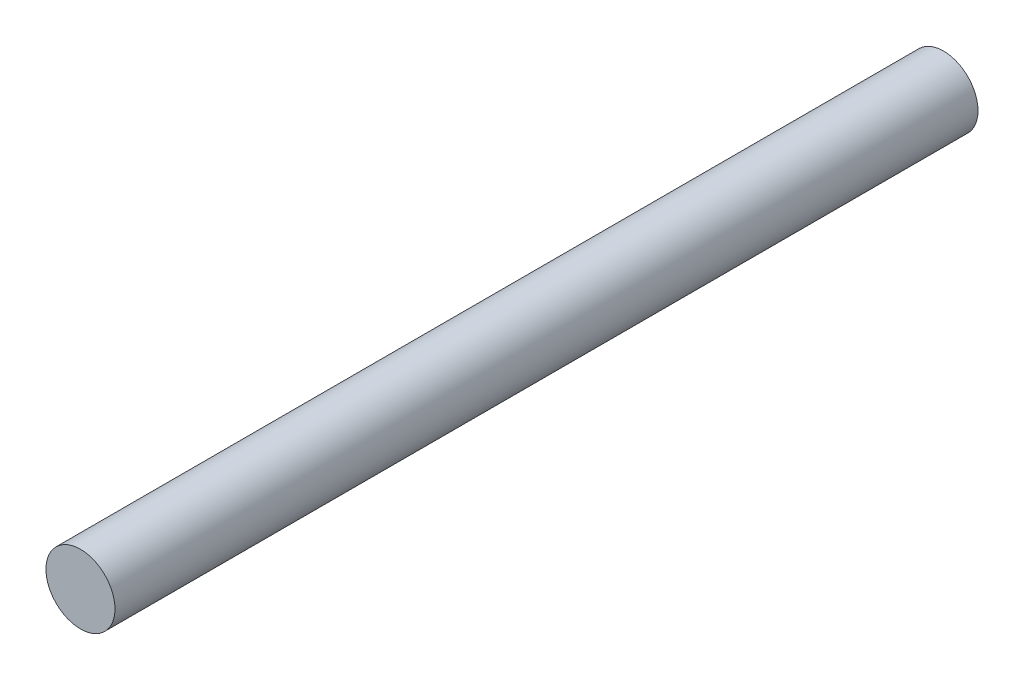
from build123d import *

# Parameters (mm, degrees)
SKIZZE1_R                       = 6
AUFSATZ_LINEAR_AUSTRAGEN1_DEPTH = 150


with BuildPart() as part:
    # Skizze1 → Aufsatz-Linear austragen1 (new body)
    with BuildSketch(Plane.XY):
        Circle(SKIZZE1_R)
    extrude(amount=AUFSATZ_LINEAR_AUSTRAGEN1_DEPTH)


solid = part.part
